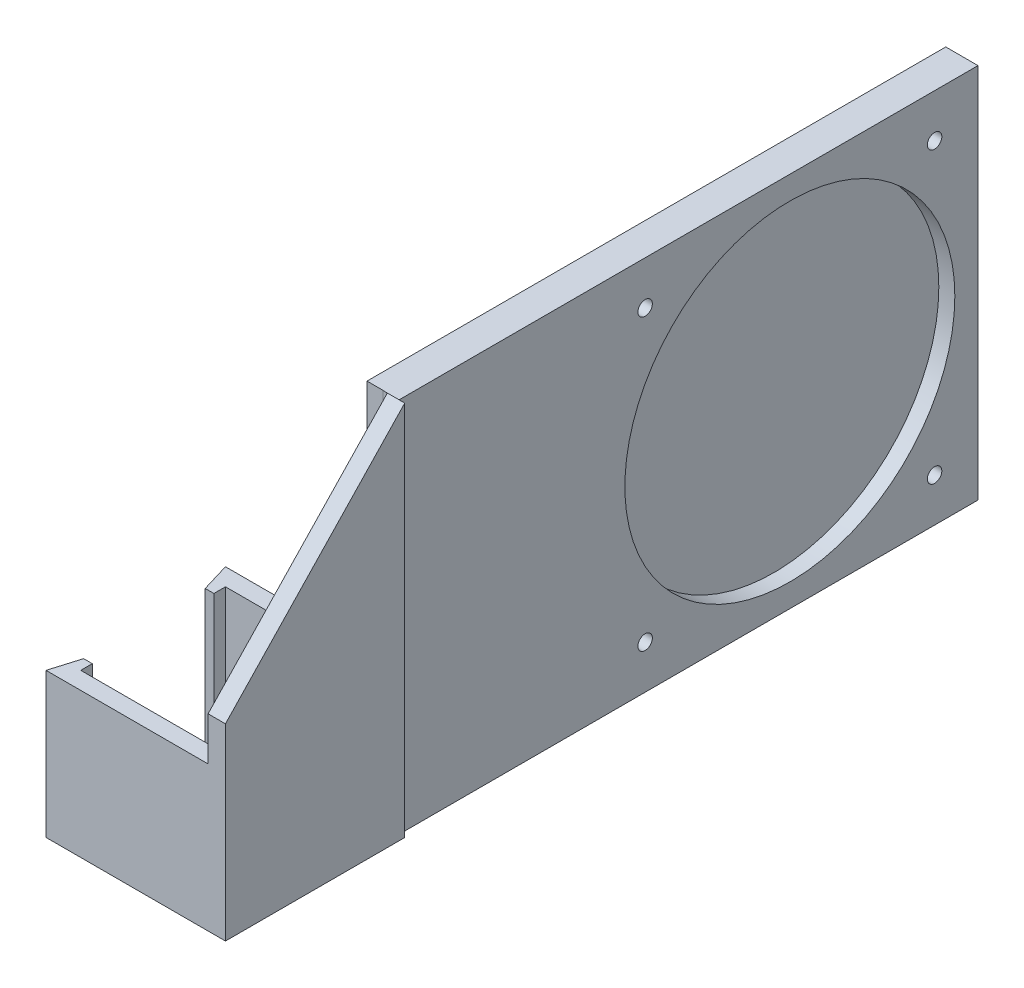
from build123d import *

# Parameters (mm, degrees)
EXTRUDE_1_DEPTH      = 25
CUT_EXTRUDE_4_DEPTH  = 80.457942189
SKETCH_7_W           = 16.60831278
SKETCH_7_H           = 38.473598513
CUT_EXTRUDE_14_DEPTH = 80.457942189
SKETCH_8_W           = 5
SKETCH_8_H           = 30.968526609
EXTRUDE_2_DEPTH      = 25
SKETCH_9_W           = 2.765387297
SKETCH_9_H           = 65
EXTRUDE_3_DEPTH      = 100
SKETCH_10_W          = 5.026813651
SKETCH_10_H          = 30.968526609
EXTRUDE_4_DEPTH      = 40
CUT_EXTRUDE_15_DEPTH = 100
SKETCH_12_R          = 28.5
CUT_EXTRUDE_16_DEPTH = 100
SKETCH_13_R          = 1.25
CUT_EXTRUDE_17_DEPTH = 100
SKETCH_14_W          = 2.026813651
SKETCH_14_H          = 30.968526609
CUT_EXTRUDE_19_DEPTH = 100
EXTRUDE_5_REACH      = 166.009
SKETCH_16_W          = 2.808181224
SKETCH_16_H          = 99.974557172


with BuildPart() as part:
    # Эскиз1 → Бобышка-Вытянуть1 (new body)
    with BuildSketch(Plane(origin=(0, 0, 0), x_dir=(1, 0, 0), z_dir=(0, 1, 0))):
        Polygon((-66.825757576, 34.969739794), (-66.825757576, 29.969739794), (-63.825757576, 29.969739794), (-63.825757576, 31.969739794), (-38.825757576, 31.969739794), (-38.825757576, 6.969739794), (-63.825757576, 6.969739794), (-63.825757576, 8.969739794), (-66.825757576, 8.969739794), (-66.825757576, 3.969739794), (-22.123470102, 3.969739794), (-36.579007505, 34.969739794), align=None)
    extrude(amount=EXTRUDE_1_DEPTH)

    # Эскиз3 → Вырез-Вытянуть4 (cut, through all)
    with BuildSketch(Plane.XZ):
        Polygon((-66.825757576, -3.969739794), (-65.325757576, -8.969739794), (-66.825757576, -8.969739794), align=None)
        Polygon((-66.825757576, -29.969739794), (-66.825757576, -34.969739794), (-65.325757576, -29.969739794), align=None)
    extrude(amount=-CUT_EXTRUDE_4_DEPTH, mode=Mode.SUBTRACT)

    # Эскиз7 → Вырез-Вытянуть14 (cut, through all)
    with BuildSketch(Plane(origin=(0, 0, 0), x_dir=(-1, 0, 0), z_dir=(0, -1, 0))):
        with Locations((27.703474463, 20.539743139)):
            Rectangle(SKETCH_7_W, SKETCH_7_H)
    extrude(amount=-CUT_EXTRUDE_14_DEPTH, mode=Mode.SUBTRACT)

    # Эскиз8 → Бобышка-Вытянуть2 (add)
    with BuildSketch(Plane(origin=(0, 0, 0), x_dir=(-1, 0, 0), z_dir=(0, -1, 0))):
        with Locations((36.298943925, 19.454003098)):
            Rectangle(SKETCH_8_W, SKETCH_8_H)
    extrude(amount=-EXTRUDE_2_DEPTH)

    # Эскиз9 → Бобышка-Вытянуть3 (add)
    with BuildSketch(Plane(origin=(0, 0, -34.938266403), x_dir=(-1, 0, 0), z_dir=(0, 0, -1))):
        with Locations((38.181637573, 32.5)):
            Rectangle(SKETCH_9_W, SKETCH_9_H)
    extrude(amount=EXTRUDE_3_DEPTH)

    # Эскиз10 → Бобышка-Вытянуть4 (add)
    with BuildSketch(Plane(origin=(0, 25, 0), x_dir=(1, 0, 0), z_dir=(0, 1, 0))):
        with Locations((-36.312350751, 19.454003098)):
            Rectangle(SKETCH_10_W, SKETCH_10_H)
    extrude(amount=EXTRUDE_4_DEPTH)

    # Эскиз11 → Вырез-Вытянуть15 (cut)
    with BuildSketch(Plane(origin=(-33.798943925, 0, 0), x_dir=(0, 0, -1), z_dir=(1, 0, 0))):
        Polygon((34.938266403, 65), (3.969739794, 32.5), (3.969739794, 65), align=None)
    extrude(amount=-CUT_EXTRUDE_15_DEPTH, mode=Mode.SUBTRACT)

    # Эскиз12 → Вырез-Вытянуть16 (cut)
    with BuildSketch(Plane(origin=(-36.798943925, 0, 0), x_dir=(0, 0, -1), z_dir=(1, 0, 0))):
        with Locations((102.438266403, 32.5)):
            Circle(SKETCH_12_R)
    extrude(amount=-CUT_EXTRUDE_16_DEPTH, mode=Mode.SUBTRACT)

    # Эскиз13 → Вырез-Вытянуть17 (cut)
    with BuildSketch(Plane(origin=(-36.798943925, 0, 0), x_dir=(0, 0, -1), z_dir=(1, 0, 0))):
        with Locations((77.438266403, 57.5)):
            Circle(SKETCH_13_R)
        with Locations((127.438266403, 57.5)):
            Circle(SKETCH_13_R)
        with Locations((127.438266403, 7.5)):
            Circle(SKETCH_13_R)
        with Locations((77.438266403, 7.5)):
            Circle(SKETCH_13_R)
    extrude(amount=-CUT_EXTRUDE_17_DEPTH, mode=Mode.SUBTRACT)

    # Эскиз14 → Вырез-Вытянуть19 (cut)
    with BuildSketch(Plane.XZ):
        with Locations((-34.812350751, -19.454003098)):
            Rectangle(SKETCH_14_W, SKETCH_14_H)
    extrude(amount=-CUT_EXTRUDE_19_DEPTH, mode=Mode.SUBTRACT)

    # Бобышка-Вытянуть5: up to this face of the body (flat: up to its plane)
    extrude_5_end = Plane(part.part.faces().sort_by_distance((-38.181637574, 65, -84.938266403))[0])
    # Эскиз16 → Бобышка-Вытянуть5 (add, up to the picked face)
    with BuildSketch(Plane.XZ, mode=Mode.PRIVATE) as extrude_5_sk1:
        with Locations((-40.968421834, -84.95701838)):
            Rectangle(SKETCH_16_W, SKETCH_16_H)
    extrude_5_tool1 = split(extrude(extrude_5_sk1.sketch, amount=-EXTRUDE_5_REACH, mode=Mode.PRIVATE), bisect_by=extrude_5_end, keep=Keep.BOTH, mode=Mode.PRIVATE)
    add(extrude_5_tool1.solids().sort_by(Axis((-40.968422, 0, -84.957018), (0, 1, 0)))[0])


solid = part.part
